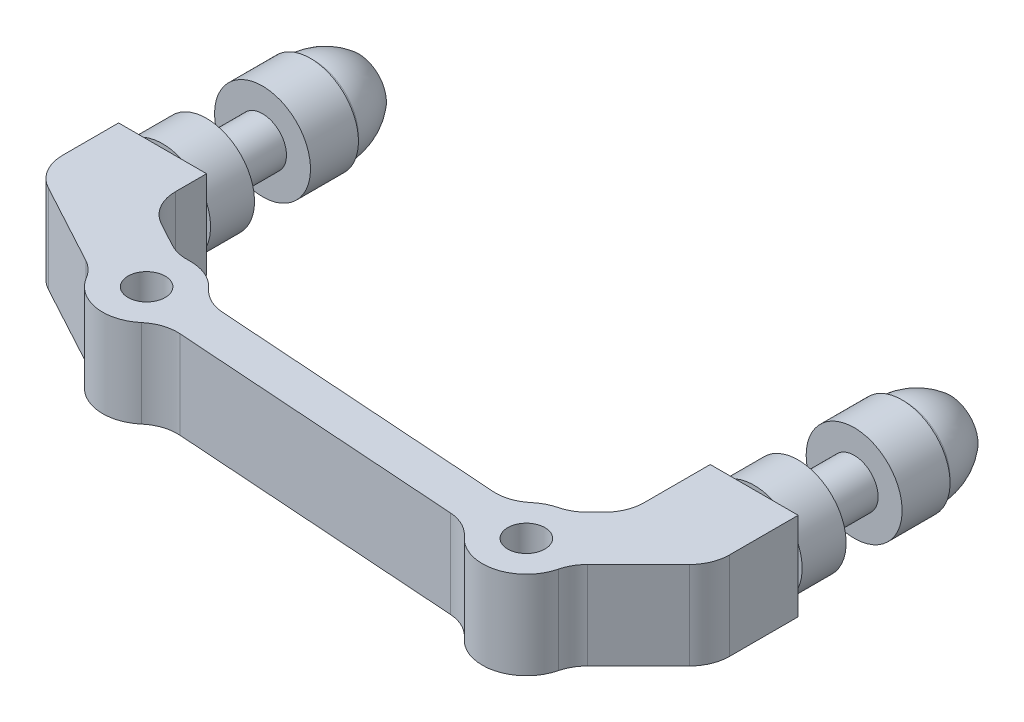
from build123d import *

# Parameters (mm, degrees)
SKETCH1_R           = 2.328285793
BOSS_EXTRUDE1_DEPTH = 5.5
FILLET1_R           = 5
SKETCH3_R           = 6
BOSS_EXTRUDE2_DEPTH = 5.5
SKETCH4_R           = 3
BOSS_EXTRUDE3_DEPTH = 7
LPATTERN1_COUNT     = 2
LPATTERN1_PITCH     = 74


with BuildPart() as part:
    # Sketch1 → Boss-Extrude1 (new, symmetric)
    with BuildSketch(Plane(origin=(0, 0, 0), x_dir=(1, 0, 0), z_dir=(0, 1, 0))):
        with BuildLine():
            Line((0, 0), (11, 0))
            Line((11, 0), (11, -6.854633107))
            Line((11, -6.854633107), (18.08275142, -10.685735567))
            ThreePointArc((18.08275142, -10.685735567), (21.90921539, -11.055742603), (24.558649677, -13.841281989))
            Line((24.558649677, -13.841281989), (65.78368238, -16.6704509))
            ThreePointArc((65.78368238, -16.6704509), (67.721094199, -14.75366641), (70.340842438, -14.002303312))
            Line((70.340842438, -14.002303312), (74, -10.343145751))
            Line((74, -10.343145751), (74, 0))
            Line((74, 0), (85, 0))
            Line((85, 0), (85, -10.656854249))
            Line((85, -10.656854249), (75.997696688, -19.659157562))
            ThreePointArc((75.997696688, -19.659157562), (71.523597121, -24.903910522), (65.441350323, -21.658718011))
            Line((65.441350323, -21.658718011), (24.21631762, -18.8295491))
            ThreePointArc((24.21631762, -18.8295491), (18.891090881, -21.466189686), (14.276625407, -17.722311778))
            Line((14.276625407, -17.722311778), (0, -10))
            Line((0, -10), (0, 0))
        make_face()
        with Locations(Location((19.5, -16, 0), (0, 0, 270))):
            Circle(SKETCH1_R, mode=Mode.SUBTRACT)
        with Locations(Location((70.5, -19.5, 0), (0, 0, 270))):
            Circle(SKETCH1_R, mode=Mode.SUBTRACT)
    extrude(amount=BOSS_EXTRUDE1_DEPTH, both=True)

    # Fillet1
    fillet1_edges = [part.edges().sort_by_distance(p)[0] for p in [
        (11, 0, 6.854633107),
        (18.08275142, 0, 10.685735567),
        (24.558649677, 0, 13.841281989),
        (65.78368238, 0, 16.6704509),
        (70.340842438, 0, 14.002303312),
        (74, 0, 10.343145751),
        (85, 0, 10.656854249),
        (75.997696688, 0, 19.659157562),
        (65.441350323, 0, 21.658718011),
        (24.21631762, 0, 18.8295491),
        (14.276625407, 0, 17.722311778),
        (0, 0, 10),
    ]]
    fillet(fillet1_edges, radius=FILLET1_R)

    # Sketch3 → Boss-Extrude2 (add)
    with BuildSketch(Plane(origin=(0, 0, 0), x_dir=(-1, 0, 0), z_dir=(0, 0, -1))):
        with Locations(Location((-79.5, 0, 0), (0, 0, 156.443535691))):
            Circle(SKETCH3_R)
        with Locations(Location((-5.5, 0, 0), (0, 0, 156.443535691))):
            Circle(SKETCH3_R)
    extrude(amount=BOSS_EXTRUDE2_DEPTH)

    # Sketch4 → Boss-Extrude3 (add)
    with BuildSketch(Plane(origin=(0, 0, -5.5), x_dir=(-1, 0, 0), z_dir=(0, 0, -1))):
        with Locations((-79.5, 0)):
            Circle(SKETCH4_R)
        with Locations((-5.5, 0)):
            Circle(SKETCH4_R)
    extrude(amount=BOSS_EXTRUDE3_DEPTH)

    # Sketch5 → Revolve1 (revolve)
    with BuildSketch(Plane(origin=(0, 0, 0), x_dir=(1, 0, 0), z_dir=(0, 1, 0)), mode=Mode.PRIVATE) as revolve1_sk:
        with BuildLine():
            Line((5.5, 12.5), (11.5, 12.5))
            Line((11.5, 12.5), (11.5, 18.5))
            Line((11.5, 18.5), (11, 18.5))
            Line((11, 18.5), (11, 19))
            ThreePointArc((11, 19), (10.484481189, 21.926174978), (9, 24.5))
            Line((9, 24.5), (5.5, 24.5))
            Line((5.5, 24.5), (5.5, 12.5))
        make_face()
    revolve1 = revolve(revolve1_sk.sketch.rotate(Axis((5.5, 0, -12.5), (0, 0, 1)), 180), axis=Axis((5.5, 0, -12.5), (0, 0, 1)))

    # LPattern1: Revolve1 ×2
    with Locations(*[(i * LPATTERN1_PITCH, 0, 0) for i in range(1, LPATTERN1_COUNT)]):
        add(revolve1)


solid = part.part
